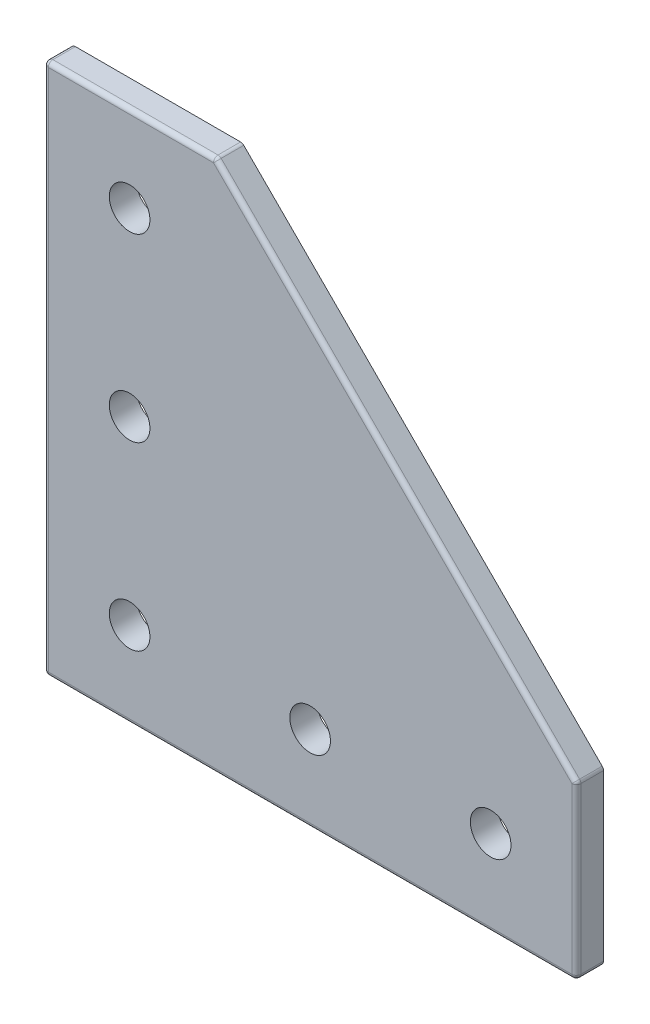
from build123d import *

# Parameters (mm, degrees)
SKETCH1_R           = 4.5
BOSS_EXTRUDE1_DEPTH = 3
FILLET1_R           = 1


with BuildPart() as part:
    # Sketch1 → Boss-Extrude1 (new, symmetric)
    with BuildSketch(Plane.XY):
        Polygon((0, 0), (0, 118), (38, 118), (118, 38), (118, 0), align=None)
        with Locations((19, 19)):
            Circle(SKETCH1_R, mode=Mode.SUBTRACT)
        with Locations((59, 19)):
            Circle(SKETCH1_R, mode=Mode.SUBTRACT)
        with Locations((99, 19)):
            Circle(SKETCH1_R, mode=Mode.SUBTRACT)
        with Locations((19, 59)):
            Circle(SKETCH1_R, mode=Mode.SUBTRACT)
        with Locations((19, 99)):
            Circle(SKETCH1_R, mode=Mode.SUBTRACT)
    extrude(amount=BOSS_EXTRUDE1_DEPTH, both=True)

    # Fillet1
    fillet1_edges = [part.edges().sort_by_distance(p)[0] for p in [
        (78, 78, 3),
        (19, 118, 3),
        (0, 59, 3),
        (59, 0, 3),
        (118, 19, 3),
        (0, 0, 0),
        (0, 118, 0),
        (38, 118, 0),
        (118, 38, 0),
        (118, 0, 0),
    ]]
    fillet(fillet1_edges, radius=FILLET1_R)


solid = part.part
